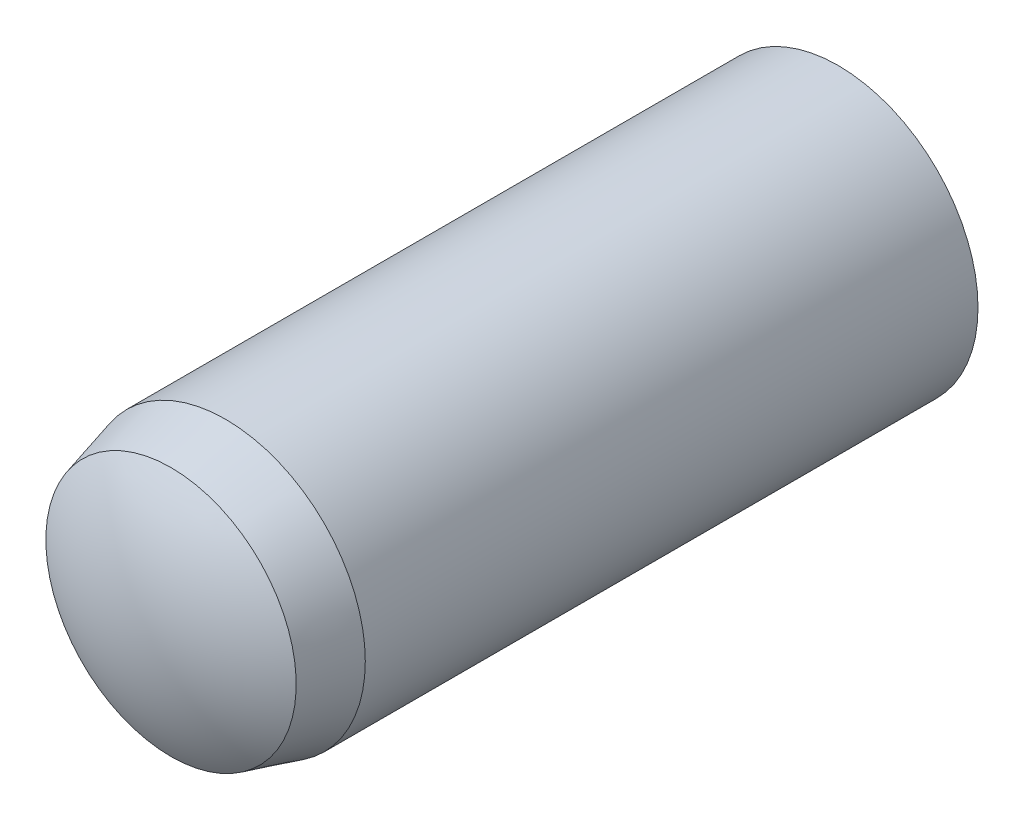
from build123d import *


with BuildPart() as part:
    # Sketch3 → Revolve1 (revolve)
    with BuildSketch(Plane(origin=(0, 0, 0), x_dir=(0, 0, -1), z_dir=(1, 0, 0))):
        with BuildLine():
            Line((-4, 0), (4, 0))
            ThreePointArc((4, 0), (3.885076627, 0.783022988), (3.55, 1.5))
            Line((3.55, 1.5), (-3.025, 1.5))
            Line((-3.025, 1.5), (-3.61, 1.343249722))
            ThreePointArc((-3.61, 1.343249722), (-3.90052754, 0.699360389), (-4, 0))
        make_face()
    revolve(axis=Axis((0, 0, 4), (0, 0, -1)))


solid = part.part
